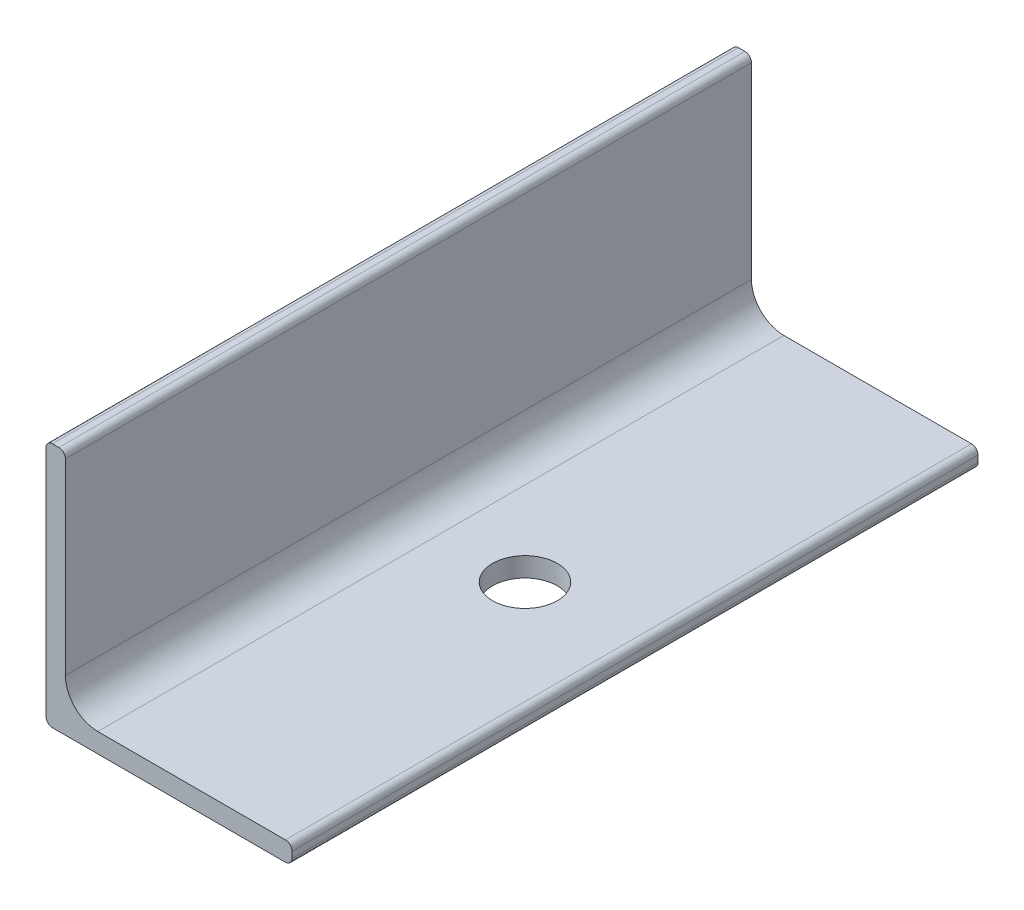
from build123d import *

# Parameters (mm, degrees)
EXTRUDE_1_DEPTH     = 53
SKETCH_2_R          = 5
CUT_EXTRUDE_1_DEPTH = 75.01351228


with BuildPart() as part:
    # 草图1 → 凸台-拉伸1 (new, symmetric)
    with BuildSketch(Plane.XY):
        with BuildLine():
            Line((0, 1), (0, 37))
            ThreePointArc((0, 37), (0.292893219, 37.707106781), (1, 38))
            Line((1, 38), (2, 38))
            ThreePointArc((2, 38), (2.707106781, 37.707106781), (3, 37))
            Line((3, 37), (3, 8))
            ThreePointArc((3, 8), (4.464466094, 4.464466094), (8, 3))
            Line((8, 3), (37, 3))
            ThreePointArc((37, 3), (37.707106781, 2.707106781), (38, 2))
            Line((38, 2), (38, 1))
            ThreePointArc((38, 1), (37.707106781, 0.292893219), (37, 0))
            Line((37, 0), (1, 0))
            ThreePointArc((1, 0), (0.292893219, 0.292893219), (0, 1))
        make_face()
    extrude(amount=EXTRUDE_1_DEPTH, both=True)

    # 草图2 → 切除-拉伸1 (cut, through all)
    with BuildSketch(Plane(origin=(0, 3, 0), x_dir=(1, 0, 0), z_dir=(0, 1, 0))):
        with Locations(Location((21, 0, 0), (0, 0, 270))):
            Circle(SKETCH_2_R)
    extrude(amount=-CUT_EXTRUDE_1_DEPTH, mode=Mode.SUBTRACT)


solid = part.part
